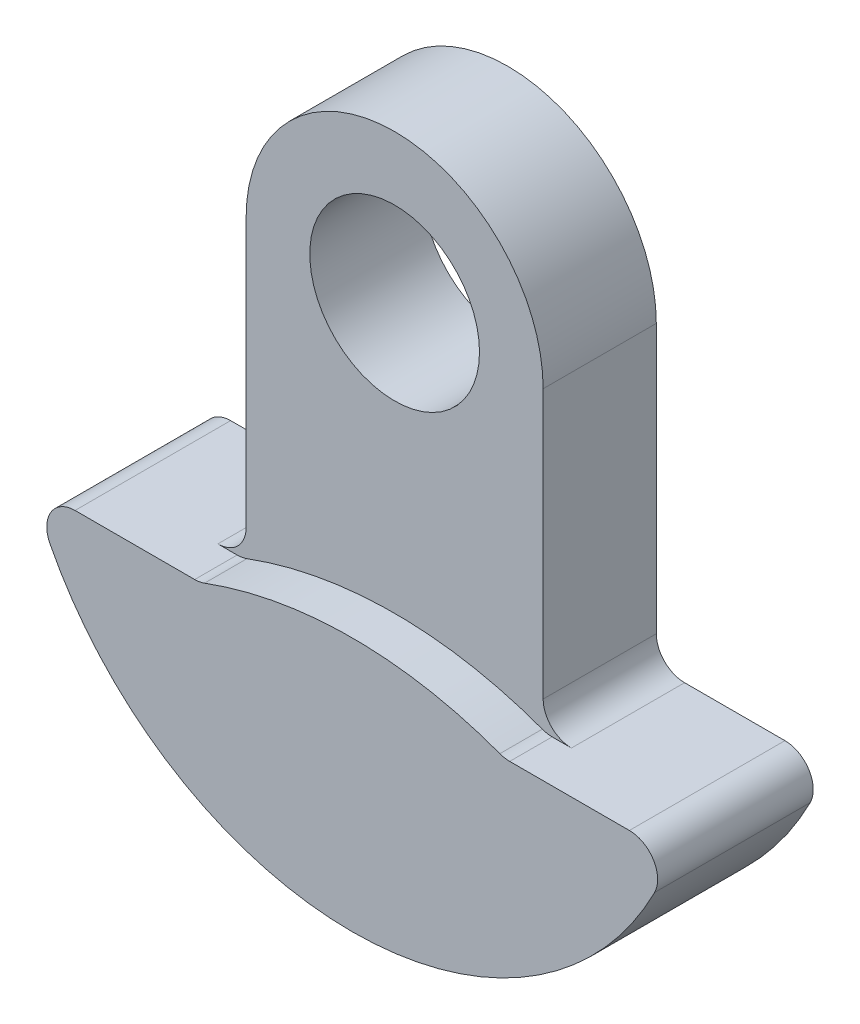
from build123d import *

# Parameters (mm, degrees)
BASE_EXTRUSION_DEPTH    = 8
BOSS_EXTRU_1_DEPTH      = 3
ESQUISSE4_R             = 6
ENL_V_MAT_EXTRU_1_DEPTH = 34.262346156
ESQUISSE5_R             = 5
ENL_V_MAT_EXTRU_2_DEPTH = 6.5
BOSS_EXTRU_2_START      = 1
ESQUISSE6_R             = 6.5
ESQUISSE6_R_2           = 5
BOSS_EXTRU_2_DEPTH      = 1


with BuildPart() as part:
    # Esquisse1 → Base-Extrusion (new body)
    with BuildSketch(Plane.XY):
        with BuildLine():
            Line((-10.5, 13), (-10.5, -6))
            ThreePointArc((-10.5, -6), (-11.085786438, -7.414213562), (-12.5, -8))
            Line((-12.5, -8), (-19.595917942, -8))
            ThreePointArc((-19.595917942, -8), (-21.301523673, -8.955534064), (-21.377365028, -10.909090909))
            ThreePointArc((-21.377365028, -10.909090909), (0, -24), (21.377365028, -10.909090909))
            ThreePointArc((21.377365028, -10.909090909), (21.301523673, -8.955534064), (19.595917942, -8))
            Line((19.595917942, -8), (12.5, -8))
            ThreePointArc((12.5, -8), (11.085786438, -7.414213562), (10.5, -6))
            Line((10.5, -6), (10.5, 13))
            ThreePointArc((10.5, 13), (0, 23.5), (-10.5, 13))
        make_face()
    extrude(amount=BASE_EXTRUSION_DEPTH)

    # Esquisse2 → Boss.-Extru.1 (add)
    with BuildSketch(Plane.XY.offset(8)):
        with BuildLine():
            Line((-19.595917942, -8), (-11.135528726, -8))
            ThreePointArc((-11.135528726, -8), (-10.781975335, -7.968501969), (-10.43955818, -7.875))
            ThreePointArc((-10.43955818, -7.875), (0, -6), (10.43955818, -7.875))
            ThreePointArc((10.43955818, -7.875), (10.781975335, -7.968501969), (11.135528726, -8))
            Line((11.135528726, -8), (19.595917942, -8))
            ThreePointArc((19.595917942, -8), (21.301523673, -8.955534064), (21.377365028, -10.909090909))
            ThreePointArc((21.377365028, -10.909090909), (0, -24), (-21.377365028, -10.909090909))
            ThreePointArc((-21.377365028, -10.909090909), (-21.301523673, -8.955534064), (-19.595917942, -8))
        make_face()
    extrude(amount=BOSS_EXTRU_1_DEPTH)

    # Esquisse4 → Enlèv. mat.-Extru.1 (cut, through all)
    with BuildSketch(Plane.XY.offset(8)):
        with Locations((0, 13)):
            Circle(ESQUISSE4_R)
    extrude(amount=-ENL_V_MAT_EXTRU_1_DEPTH, mode=Mode.SUBTRACT)

    # Esquisse5 → Enlèv. mat.-Extru.2 (cut)
    with BuildSketch(Plane(origin=(0, 0, 0), x_dir=(-1, 0, 0), z_dir=(0, 0, -1))):
        Circle(ESQUISSE5_R)
    extrude(amount=-ENL_V_MAT_EXTRU_2_DEPTH, mode=Mode.SUBTRACT)

    # Esquisse6 → Boss.-Extru.2 (add)
    with BuildSketch(Plane(origin=(0, 0, 0), x_dir=(-1, 0, 0), z_dir=(0, 0, -1)).offset(BOSS_EXTRU_2_START)):
        with Locations(Location((0, 0, 0), (0, 0, 180))):
            Circle(ESQUISSE6_R)
        Circle(ESQUISSE6_R_2, mode=Mode.SUBTRACT)
    extrude(amount=-BOSS_EXTRU_2_DEPTH)


solid = part.part
